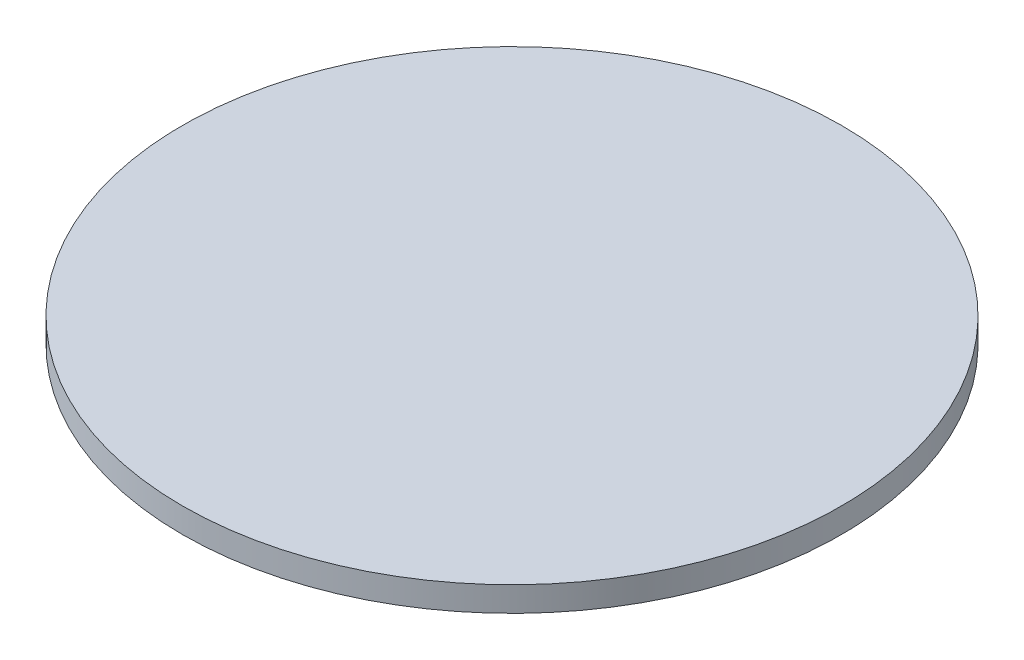
from build123d import *

# Parameters (mm, degrees)
SKETCH1_R           = 42.164
BOSS_EXTRUDE1_DEPTH = 3.175


with BuildPart() as part:
    # Sketch1 → Boss-Extrude1 (new body)
    with BuildSketch(Plane(origin=(0, 0, 0), x_dir=(1, 0, 0), z_dir=(0, 1, 0))):
        with Locations(Location((0, 0, 0), (0, 0, 270))):
            Circle(SKETCH1_R)
    extrude(amount=BOSS_EXTRUDE1_DEPTH)


solid = part.part
